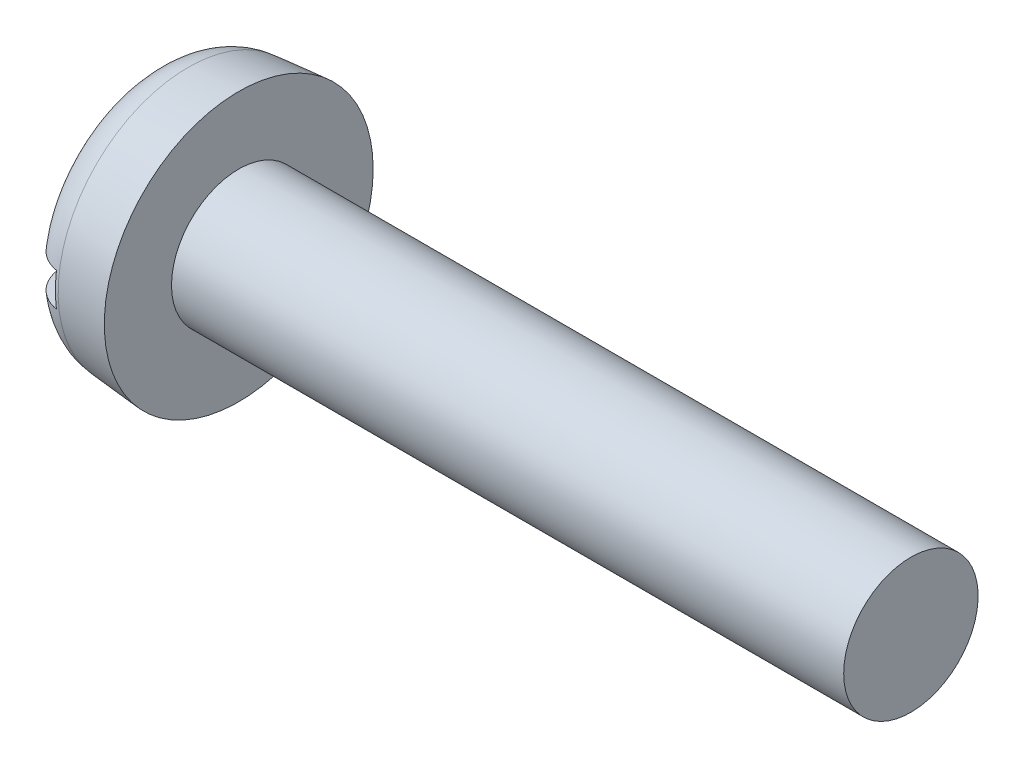
from build123d import *

# Parameters (mm, degrees)
FILLET2_R  = 0.6
SKETCH2_W  = 4
SKETCH2_H  = 0.5
SLOT_DEPTH = 0.5


with BuildPart() as part:
    # BodySke → Base-Revolve (revolve)
    with BuildSketch(Plane.XY, mode=Mode.PRIVATE) as base_revolve_sk:
        Polygon((1.3, 1), (1.3, 2), (0, 1.886264737), (0, 0), (11.3, 0), (11.3, 1), align=None)
    revolve(base_revolve_sk.sketch.rotate(Axis((-25.4, 0, 0), (1, 0, 0)), 90), axis=Axis((-25.4, 0, 0), (1, 0, 0)))

    # Fillet2
    fillet2_edges = [part.edges().sort_by_distance(p)[0] for p in [
        (0, 0, -1.886264737),
    ]]
    fillet(fillet2_edges, radius=FILLET2_R)

    # Sketch2 → Slot (cut)
    with BuildSketch(Plane(origin=(0, 0, 0), x_dir=(0, 0, -1), z_dir=(1, 0, 0))):
        Rectangle(SKETCH2_W, SKETCH2_H)
    extrude(amount=SLOT_DEPTH, mode=Mode.SUBTRACT)


solid = part.part
